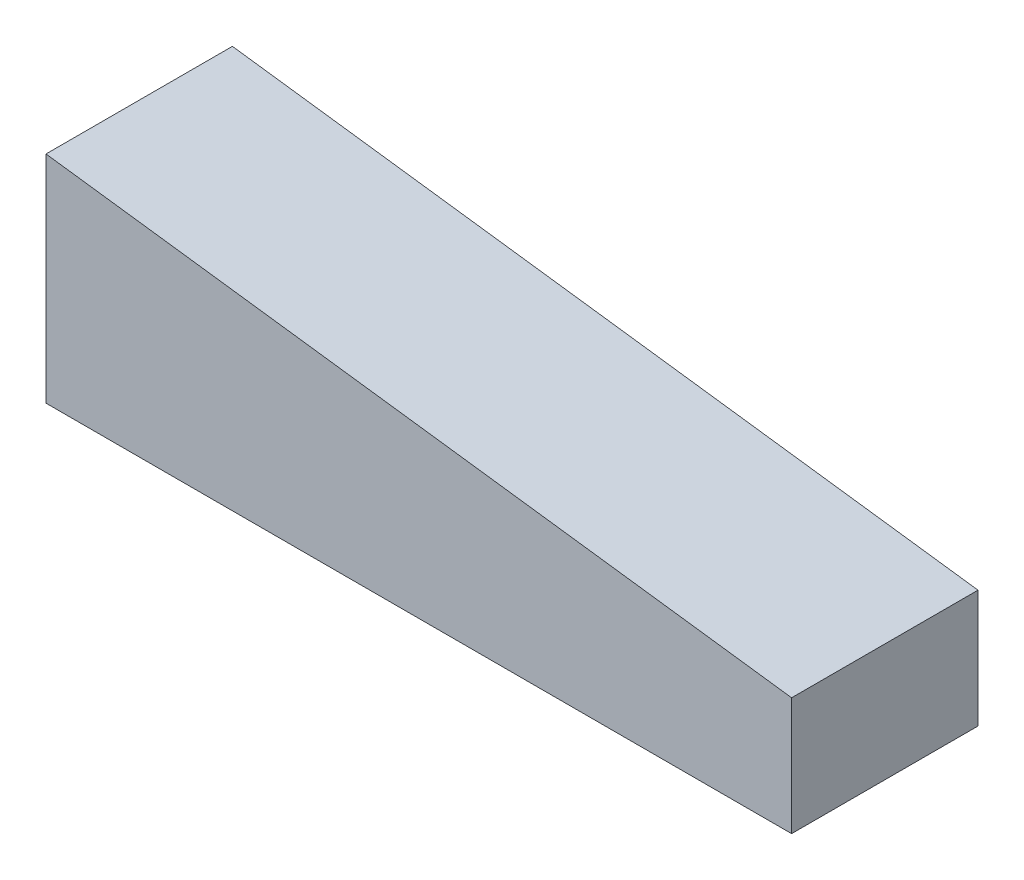
from build123d import *

# Parameters (mm, degrees)
BOSS_EXTRUDE1_DEPTH = 6.35


with BuildPart() as part:
    # Sketch1 → Boss-Extrude1 (new, symmetric)
    with BuildSketch(Plane.XY):
        Polygon((0, 0), (0, 14.706384063), (50.8, 8.018437186), (50.8, 0), align=None)
    extrude(amount=BOSS_EXTRUDE1_DEPTH, both=True)


solid = part.part
